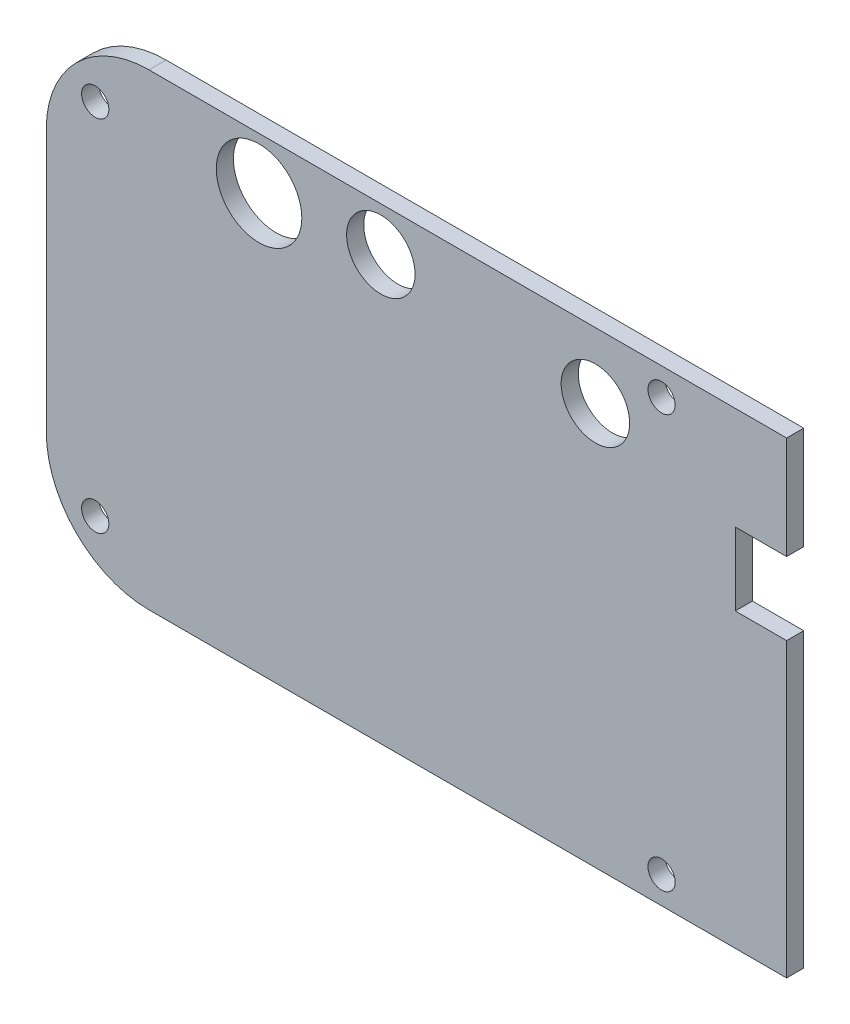
from build123d import *

# Parameters (mm, degrees)
ESBO_O1_W                = 86.5
ESBO_O1_H                = 54.64
RESSALTO_EXTRUS_O2_DEPTH = 2
ESBO_O3_R                = 1.59
CORTE_EXTRUS_O1_DEPTH    = 2
FILETE1_R                = 12
FILETE2_R                = 12
ESBO_O4_R                = 5
ESBO_O4_R_2              = 4
ESBO_O4_W                = 6
ESBO_O4_H                = 8.5
CORTE_EXTRUS_O2_DEPTH    = 10


with BuildPart() as part:
    # Esboço1 → Ressalto-extrusão2 (new body)
    with BuildSketch(Plane.XY):
        with Locations((43.25, 27.32)):
            Rectangle(ESBO_O1_W, ESBO_O1_H)
    extrude(amount=RESSALTO_EXTRUS_O2_DEPTH)

    # Esboço3 → Corte-extrusão1 (cut)
    with BuildSketch(Plane(origin=(0, 0, 0), x_dir=(-1, 0, 0), z_dir=(0, 0, -1))):
        with Locations((-71.89, 51.46)):
            Circle(ESBO_O3_R)
        with Locations((-71.89, 3.18)):
            Circle(ESBO_O3_R)
        with Locations((-5.72, 6.35)):
            Circle(ESBO_O3_R)
        with Locations((-5.72, 48.29)):
            Circle(ESBO_O3_R)
    extrude(amount=-CORTE_EXTRUS_O1_DEPTH, mode=Mode.SUBTRACT)

    # Filete1
    filete1_edges = [part.edges().sort_by_distance(p)[0] for p in [
        (0, 54.64, 1),
    ]]
    fillet(filete1_edges, radius=FILETE1_R)

    # Filete2
    filete2_edges = [part.edges().sort_by_distance(p)[0] for p in [
        (0, 0, 1),
    ]]
    fillet(filete2_edges, radius=FILETE2_R)

    # Esboço4 → Corte-extrusão2 (cut)
    with BuildSketch(Plane.XY.offset(2)):
        with Locations((24.86, 48.58)):
            Circle(ESBO_O4_R)
        with Locations((39.09, 49.5)):
            Circle(ESBO_O4_R_2)
        with Locations((64.16, 46.97)):
            Circle(ESBO_O4_R_2)
        with Locations((83.5, 38.39)):
            Rectangle(ESBO_O4_W, ESBO_O4_H)
    extrude(amount=-CORTE_EXTRUS_O2_DEPTH, mode=Mode.SUBTRACT)


solid = part.part
